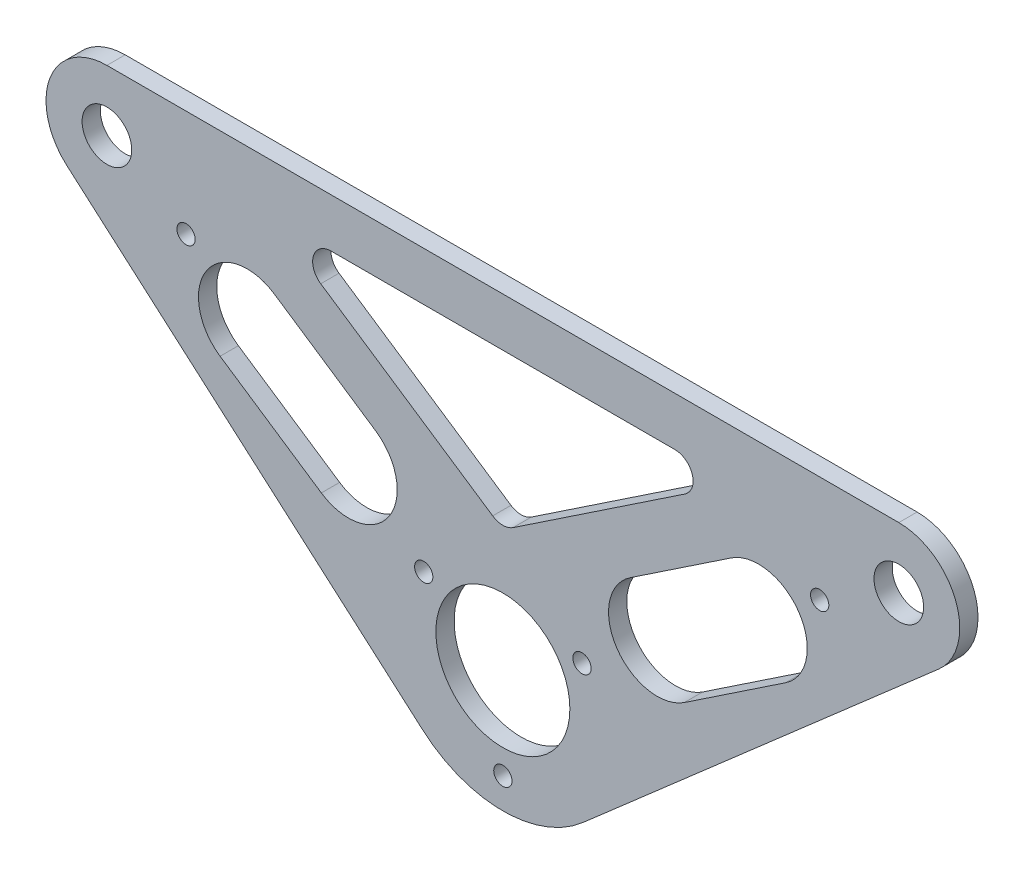
from build123d import *

# Parameters (mm, degrees)
SKETCH1_R               = 11
SKETCH1_R_2             = 4.075
BOSS_EXTRUDE1_DEPTH     = 1.5
CUT_EXTRUDE1_DEPTH      = 93.138482731
CUT_EXTRUDE1_DEPTH_BACK = 93.138482731
SKETCH2_R               = 1.5
SKETCH3_R               = 1.5
CUT_EXTRUDE2_DEPTH      = 93.138482731
FILLET2_R               = 3


with BuildPart() as part:
    # Sketch1 → Boss-Extrude1 (new, symmetric)
    with BuildSketch(Plane.XY):
        with BuildLine():
            Line((-71.578668004, 35.968657006), (-13.157336008, -15.062685988))
            ThreePointArc((-13.157336008, -15.062685988), (0, -20), (13.157336008, -15.062685988))
            Line((13.157336008, -15.062685988), (71.578668004, 35.968657006))
            ThreePointArc((71.578668004, 35.968657006), (74.362516487, 47.013301158), (65, 53.5))
            Line((65, 53.5), (-65, 53.5))
            ThreePointArc((-65, 53.5), (-74.362516487, 47.013301158), (-71.578668004, 35.968657006))
        make_face()
        Circle(SKETCH1_R, mode=Mode.SUBTRACT)
        with Locations((-65, 43.5)):
            Circle(SKETCH1_R_2, mode=Mode.SUBTRACT)
        with Locations((65, 43.5)):
            Circle(SKETCH1_R_2, mode=Mode.SUBTRACT)
        Polygon((-38.103448276, 45.5), (38.103448276, 45.5), (0, 20), align=None, mode=Mode.SUBTRACT)
        with BuildLine():
            Line((-37.519409883, 34.735340535), (-20.898100342, 23.611848765))
            ThreePointArc((-20.898100342, 23.611848765), (-18.698973233, 12.513928241), (-29.796893758, 10.314801132))
            Line((-29.796893758, 10.314801132), (-46.418203298, 21.438292902))
            ThreePointArc((-46.418203298, 21.438292902), (-48.617330407, 32.536213426), (-37.519409883, 34.735340535))
        make_face(mode=Mode.SUBTRACT)
        with BuildLine():
            Line((37.519409883, 34.735340535), (20.898100342, 23.611848765))
            ThreePointArc((20.898100342, 23.611848765), (18.698973233, 12.513928241), (29.796893758, 10.314801132))
            Line((29.796893758, 10.314801132), (46.418203298, 21.438292902))
            ThreePointArc((46.418203298, 21.438292902), (48.617330407, 32.536213426), (37.519409883, 34.735340535))
        make_face(mode=Mode.SUBTRACT)
    extrude(amount=BOSS_EXTRUDE1_DEPTH, both=True)

    # Sketch2 → Cut-Extrude1 (cut, two sides: drawn at the far end of the back side and taken through both)
    with BuildSketch(Plane.XY.offset(-CUT_EXTRUDE1_DEPTH_BACK)):
        with Locations((0, -15)):
            Circle(SKETCH2_R)
        with Locations((-12.988881057, 7.500866025)):
            Circle(SKETCH2_R)
        with Locations((12.991881057, 7.499133975)):
            Circle(SKETCH2_R)
    extrude(amount=CUT_EXTRUDE1_DEPTH + CUT_EXTRUDE1_DEPTH_BACK, mode=Mode.SUBTRACT)

    # Sketch3 → Cut-Extrude2 (cut, symmetric)
    with BuildSketch(Plane.XY):
        with Locations((-65, 58.5)):
            Circle(SKETCH3_R)
        with Locations((-52.009618943, 36)):
            Circle(SKETCH3_R)
        with Locations((-77.990381057, 36)):
            Circle(SKETCH3_R)
    cut_extrude2 = extrude(amount=CUT_EXTRUDE2_DEPTH, both=True, mode=Mode.SUBTRACT)

    # Mirror1: Cut-Extrude2 across plane
    add(cut_extrude2.mirror(Plane(origin=(0, 0, 0), x_dir=(0, 0, 1), z_dir=(1, 0, 0))), mode=Mode.SUBTRACT)

    # Fillet2
    fillet2_edges = [part.edges().sort_by_distance(p)[0] for p in [
        (0, 20, 0),
        (38.103448276, 45.5, 0),
        (-38.103448276, 45.5, 0),
    ]]
    fillet(fillet2_edges, radius=FILLET2_R)


solid = part.part
